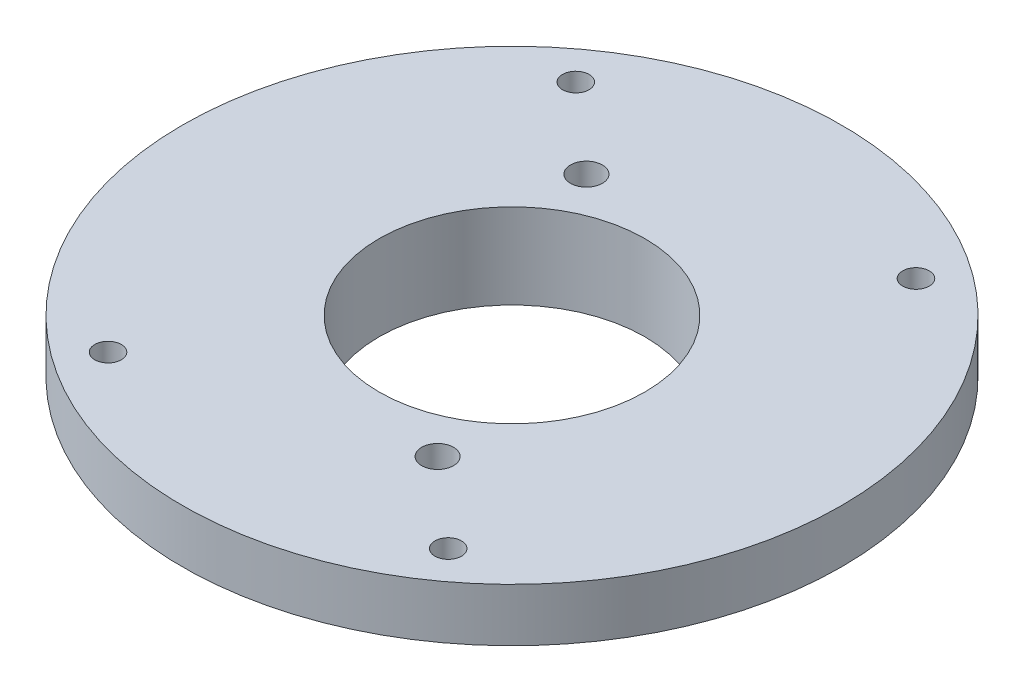
from build123d import *

# Parameters (mm, degrees)
ESQUISSE2_R             = 1.25
ESQUISSE2_R_2           = 1.5
ENL_V_MAT_EXTRU_1_DEPTH = 8


with BuildPart() as part:
    # Esquisse1 → Révolution1 (revolve)
    with BuildSketch(Plane.XY):
        Polygon((-12.5, 8), (-31, 8), (-31, 3), (-22.5, 3), (-22.5, 0), (-12.5, 0), (-12.5, 7.91388756), align=None)
    revolve(axis=Axis((0, 10, 0), (0, -1, 0)))

    # Esquisse2 → Enlèv. mat.-Extru.1 (cut)
    with BuildSketch(Plane(origin=(0, 8, 0), x_dir=(1, 0, 0), z_dir=(0, 1, 0))):
        with Locations(Location((-16, 22, 0), (0, 0, 180))):
            Circle(ESQUISSE2_R)
        with Locations(Location((16, 22, 0), (0, 0, 180))):
            Circle(ESQUISSE2_R)
        with Locations(Location((16, -22, 0), (0, 0, 180))):
            Circle(ESQUISSE2_R)
        with Locations(Location((-16, -22, 0), (0, 0, 180))):
            Circle(ESQUISSE2_R)
        with Locations(Location((-8, 15, 0), (0, 0, 180))):
            Circle(ESQUISSE2_R_2)
        with Locations(Location((8, -15, 0), (0, 0, 180))):
            Circle(ESQUISSE2_R_2)
    extrude(amount=-ENL_V_MAT_EXTRU_1_DEPTH, mode=Mode.SUBTRACT)


solid = part.part
